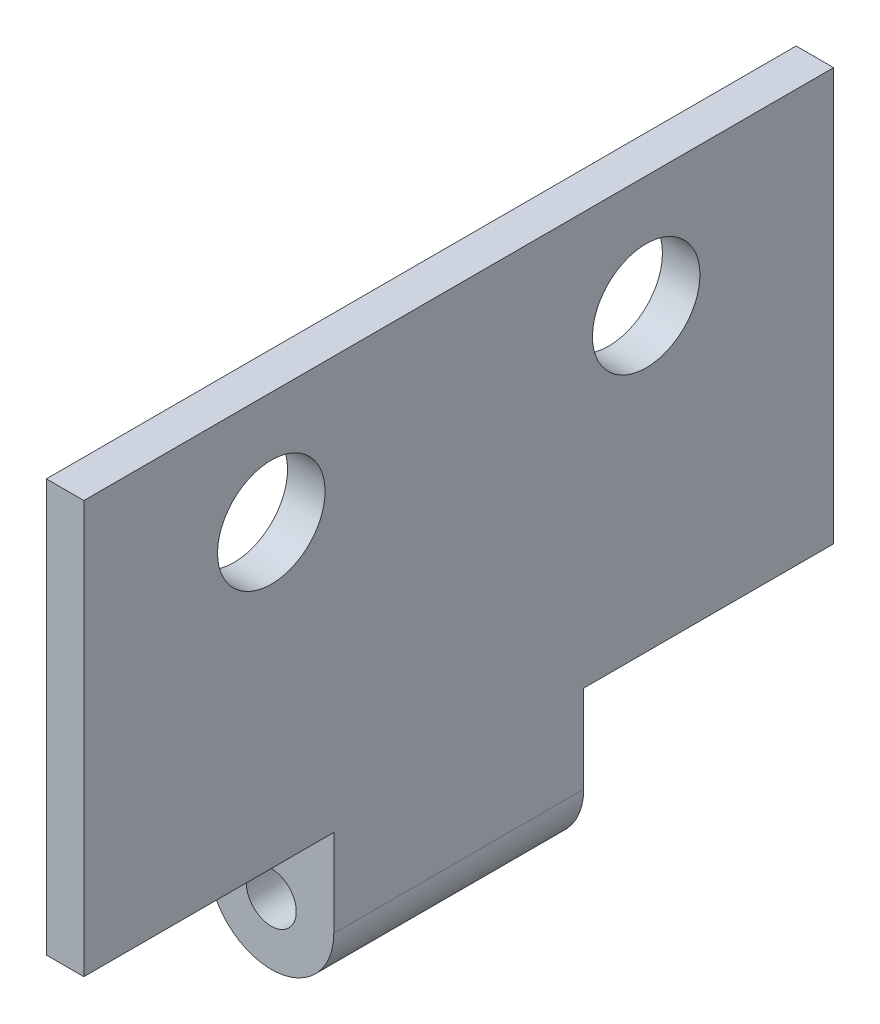
from build123d import *

# Parameters (mm, degrees)
SKETCH2_R               = 1
BOSS_EXTRUDE2_DEPTH     = 30
CUT_EXTRUDE1_DEPTH      = 37.224991373
CUT_EXTRUDE1_DEPTH_BACK = 37.224991373
SKETCH3_R               = 2.15
SKETCH3_W               = 10
SKETCH3_H               = 7


with BuildPart() as part:
    # Sketch2 → Boss-Extrude2 (new body)
    with BuildSketch(Plane.XY):
        with BuildLine():
            Line((1, 3.5), (1, 20))
            Line((1, 20), (2.5, 20))
            Line((2.5, 20), (2.5, 0))
            ThreePointArc((2.5, 0), (-1.767766953, -1.767766953), (0, 2.5))
            ThreePointArc((0, 2.5), (0.707106781, 2.792893219), (1, 3.5))
        make_face()
        Circle(SKETCH2_R, mode=Mode.SUBTRACT)
    extrude(amount=BOSS_EXTRUDE2_DEPTH)

    # Sketch3 → Cut-Extrude1 (cut, two sides: drawn at the far end of the back side and taken through both)
    with BuildSketch(Plane.ZY.offset(-1).offset(-CUT_EXTRUDE1_DEPTH_BACK)):
        with Locations(Location((7.5, 15.5, 0), (0, 0, 270))):
            Circle(SKETCH3_R)
        with Locations(Location((22.5, 15.5, 0), (0, 0, 270))):
            Circle(SKETCH3_R)
        with Locations((5, 0)):
            Rectangle(SKETCH3_W, SKETCH3_H)
        with Locations((25, 0)):
            Rectangle(SKETCH3_W, SKETCH3_H)
    extrude(amount=CUT_EXTRUDE1_DEPTH + CUT_EXTRUDE1_DEPTH_BACK, mode=Mode.SUBTRACT)


solid = part.part
